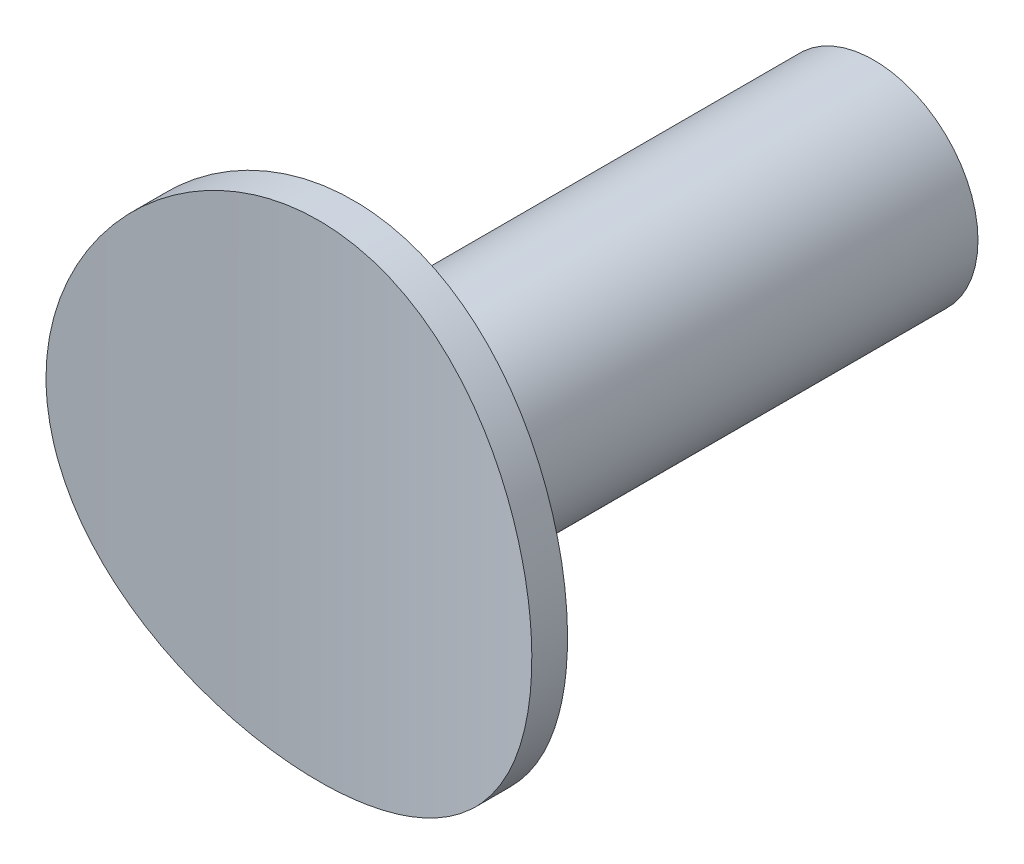
from build123d import *
from build123d.topology import SkipClean

# Parameters (mm, degrees)
CURVED_HOLDER_MAIN_BODY_SKETCH_R = 3.5
CURVED_HOLDER_MAIN_BODY_DEPTH    = 5
FILL_REMOVE_DEPTH                = 8.03562364
FILL_REMOVE_DEPTH_BACK           = 8.03562364
PIN_BODY_REACH                   = 7.036
PIN_BODY_END_RADIUS              = 15
PIN_BODY_SKETCH_R                = 1.5
PIN_BODY_DIRECTION_2_DEPTH       = 7.5


with BuildPart() as part:
    # Curved Holder Main Body Sketch → Curved Holder Main Body (new body)
    with BuildSketch(Plane.XY):
        Circle(CURVED_HOLDER_MAIN_BODY_SKETCH_R)
    extrude(amount=CURVED_HOLDER_MAIN_BODY_DEPTH)

    # Fill Remove Sketch → Fill Remove (cut, two sides: drawn at the far end of the back side and taken through both)
    with BuildSketch(Plane(origin=(0, 0, 0), x_dir=(1, 0, 0), z_dir=(0, 1, 0)).offset(-FILL_REMOVE_DEPTH_BACK)):
        with BuildLine():
            Line((3.5, -5), (3.5, -0.928752721))
            ThreePointArc((3.5, -0.928752721), (0, -0.5), (-3.5, -0.928752721))
            Line((-3.5, -0.928752721), (-3.5, -5))
            Line((-3.5, -5), (3.5, -5))
        make_face()
        with BuildLine():
            Line((-3.5, 0), (-3.5, -0.414047854))
            ThreePointArc((-3.5, -0.414047854), (0, 0), (3.5, -0.414047854))
            Line((3.5, -0.414047854), (3.5, 0))
            Line((3.5, 0), (3.5, 0.978197193))
            Line((3.5, 0.978197193), (-3.5, 0.978197193))
            Line((-3.5, 0.978197193), (-3.5, 0))
        make_face()
    extrude(amount=FILL_REMOVE_DEPTH + FILL_REMOVE_DEPTH_BACK, mode=Mode.SUBTRACT)

    # Pin Body: up to this cylinder (the profile starts outside it)
    with SkipClean():  # the faces are left unmerged after this step: merging them gives an invalid solid
        pin_body_end = Plane(origin=(0, 0, 15), z_dir=(0, 1, 0)) * Cylinder(PIN_BODY_END_RADIUS, 45.072, mode=Mode.PRIVATE)
        # Pin Body Sketch → Pin Body (add, up to the surface)
        with BuildSketch(Plane.XY, mode=Mode.PRIVATE) as pin_body_sk1:
            Circle(PIN_BODY_SKETCH_R)
        pin_body_tool1 = extrude(pin_body_sk1.sketch, amount=PIN_BODY_REACH, mode=Mode.PRIVATE) - pin_body_end
        add(pin_body_tool1.solids().sort_by_distance((0, 0, 0))[0])
        add(pin_body_tool1.solids().sort_by_distance((0, 0, 0))[1])

    # Pin Body Sketch → Pin Body direction 2 (add)
    with BuildSketch(Plane.XY):
        Circle(PIN_BODY_SKETCH_R)
    extrude(amount=-PIN_BODY_DIRECTION_2_DEPTH)


solid = part.part
